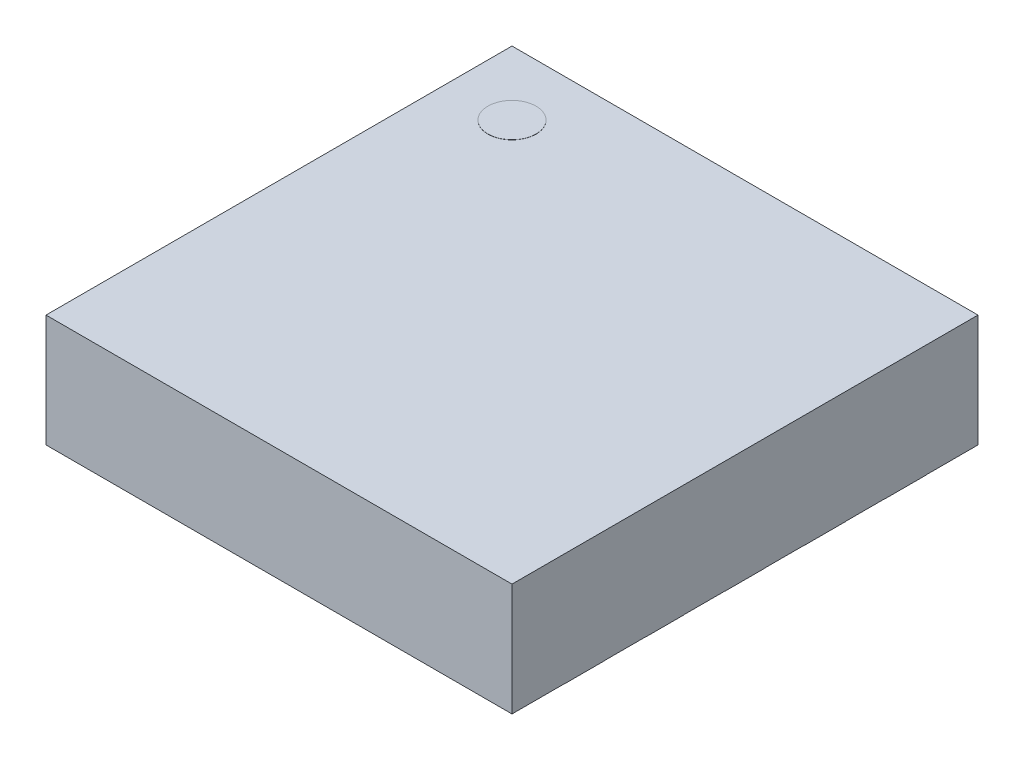
from build123d import *

# Parameters (mm, degrees)
SKETCH1_W           = 2.9
SKETCH1_H           = 2.9
BOSS_EXTRUDE1_DEPTH = 0.7
SKETCH2_W           = 0.324
SKETCH2_H           = 0.25
SKETCH2_W_2         = 1.6
SKETCH2_H_2         = 2.3
BOSS_EXTRUDE2_DEPTH = 0.001
SKETCH3_R           = 0.15
BOSS_EXTRUDE3_DEPTH = 0.001


with BuildPart() as part:
    # Sketch1 → Boss-Extrude1 (new body)
    with BuildSketch(Plane(origin=(0, 0, 0), x_dir=(1, 0, 0), z_dir=(0, 1, 0))):
        Rectangle(SKETCH1_W, SKETCH1_H)
    extrude(amount=BOSS_EXTRUDE1_DEPTH)

    # Sketch2 → Boss-Extrude2 (add)
    with BuildSketch(Plane.XZ):
        with Locations((-1.288, 0)):
            Rectangle(SKETCH2_W, SKETCH2_H)
        with Locations((-1.288, 0.5)):
            Rectangle(SKETCH2_W, SKETCH2_H)
        with Locations((-1.288, 1)):
            Rectangle(SKETCH2_W, SKETCH2_H)
        with Locations((-1.288, -1)):
            Rectangle(SKETCH2_W, SKETCH2_H)
        with Locations((-1.288, -0.5)):
            Rectangle(SKETCH2_W, SKETCH2_H)
        with Locations((1.288, -1)):
            Rectangle(SKETCH2_W, SKETCH2_H)
        with Locations((1.288, -0.5)):
            Rectangle(SKETCH2_W, SKETCH2_H)
        with Locations((1.288, 0)):
            Rectangle(SKETCH2_W, SKETCH2_H)
        with Locations((1.288, 0.5)):
            Rectangle(SKETCH2_W, SKETCH2_H)
        with Locations((1.288, 1)):
            Rectangle(SKETCH2_W, SKETCH2_H)
        Rectangle(SKETCH2_W_2, SKETCH2_H_2)
    extrude(amount=BOSS_EXTRUDE2_DEPTH)

    # Sketch3 → Boss-Extrude3 (add)
    with BuildSketch(Plane(origin=(0, 0.7, 0), x_dir=(1, 0, 0), z_dir=(0, 1, 0))):
        with Locations(Location((-1.05, 1.05, 0), (0, 0, 270))):
            Circle(SKETCH3_R)
    extrude(amount=BOSS_EXTRUDE3_DEPTH)


solid = part.part
